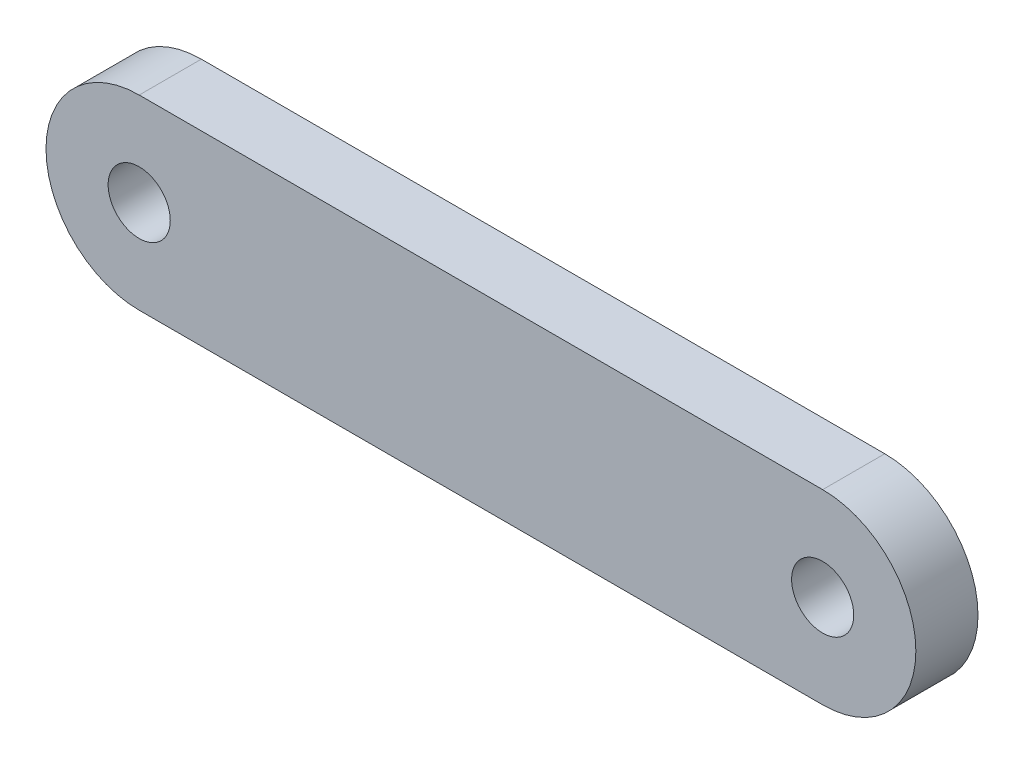
from build123d import *

# Parameters (mm, degrees)
SKETCH1_R           = 5
BOSS_EXTRUDE1_DEPTH = 10


with BuildPart() as part:
    # Sketch1 → Boss-Extrude1 (new body)
    with BuildSketch(Plane.XY):
        with BuildLine():
            Line((-55, 15), (55, 15))
            ThreePointArc((55, 15), (70, 0), (55, -15))
            Line((55, -15), (-55, -15))
            ThreePointArc((-55, -15), (-70, 0), (-55, 15))
        make_face()
        with Locations((-55, 0)):
            Circle(SKETCH1_R, mode=Mode.SUBTRACT)
        with Locations((55, 0)):
            Circle(SKETCH1_R, mode=Mode.SUBTRACT)
    extrude(amount=BOSS_EXTRUDE1_DEPTH)


solid = part.part
